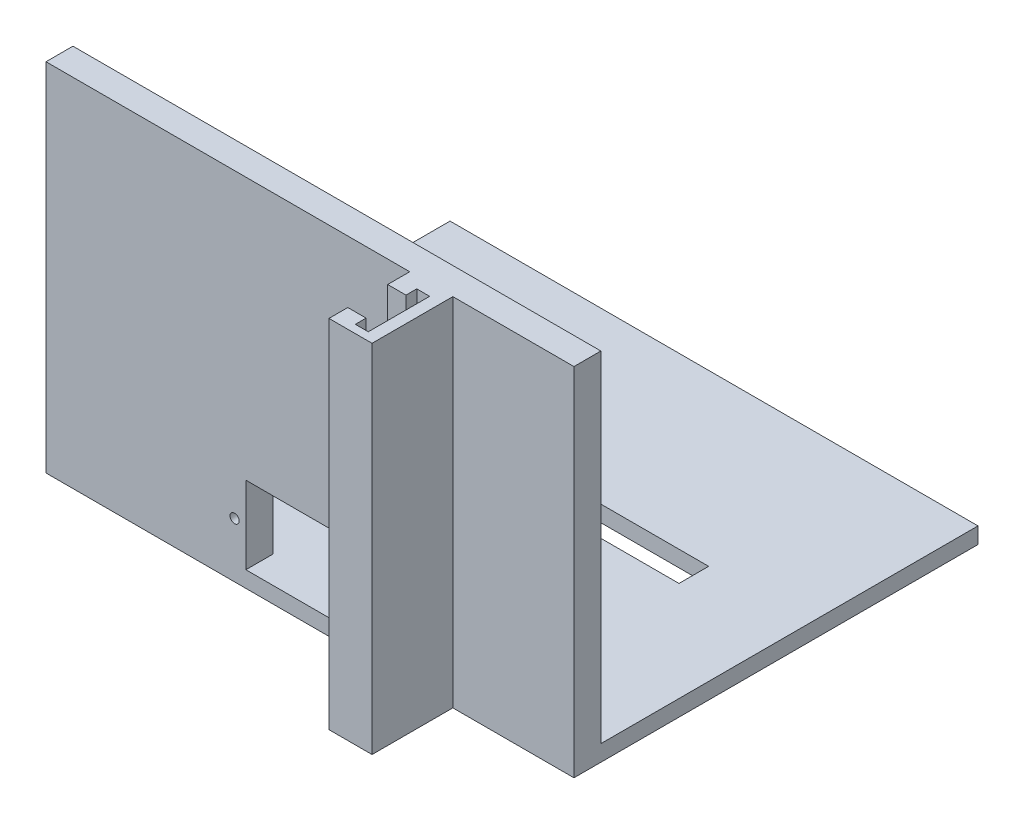
from build123d import *

# Parameters (mm, degrees)
SKETCH1_W               = 98
SKETCH1_H               = 111.829224908
SKETCH1_R               = 0.85
SKETCH1_W_2             = 23.8
SKETCH1_H_2             = 14.4
BOSS_EXTRUDE1_DEPTH     = 5
SKETCH3_W               = 98
SKETCH3_H               = 3
BOSS_EXTRUDE2_DEPTH     = 70
SKETCH4_W               = 61
SKETCH4_H               = 5.5
CUT_EXTRUDE1_DEPTH      = 50
CUT_EXTRUDE2_DEPTH      = 103.114856343
CUT_EXTRUDE2_DEPTH_BACK = 103.114856343
SKETCH5_W               = 98
SKETCH5_H               = 45.714612454
SKETCH6_W               = 8
SKETCH6_H               = 60
BOSS_EXTRUDE3_DEPTH     = 15
CUT_EXTRUDE3_DEPTH      = 109.037687776
BOSS_EXTRUDE4_DEPTH     = 6.114612454


with BuildPart() as part:
    # Sketch1 → Boss-Extrude1 (new body)
    with BuildSketch(Plane.XY):
        Rectangle(SKETCH1_W, SKETCH1_H)
        with Locations((14, 0)):
            Circle(SKETCH1_R, mode=Mode.SUBTRACT)
        with Locations((-14, 0)):
            Circle(SKETCH1_R, mode=Mode.SUBTRACT)
        Rectangle(SKETCH1_W_2, SKETCH1_H_2, mode=Mode.SUBTRACT)
    extrude(amount=BOSS_EXTRUDE1_DEPTH)

    # Sketch3 → Boss-Extrude2 (add)
    with BuildSketch(Plane(origin=(0, 0, 0), x_dir=(-1, 0, 0), z_dir=(0, 0, -1))):
        with Locations((0, -8.7)):
            Rectangle(SKETCH3_W, SKETCH3_H)
    extrude(amount=BOSS_EXTRUDE2_DEPTH)

    # Sketch4 → Cut-Extrude1 (cut)
    with BuildSketch(Plane(origin=(0, -7.2, 0), x_dir=(1, 0, 0), z_dir=(0, 1, 0))):
        with Locations((0, 35.75)):
            Rectangle(SKETCH4_W, SKETCH4_H)
    extrude(amount=-CUT_EXTRUDE1_DEPTH, mode=Mode.SUBTRACT)

    # Sketch5 → Cut-Extrude2 (cut, two sides: drawn at the far end of the back side and taken through both)
    with BuildSketch(Plane(origin=(0, 0, 0), x_dir=(-1, 0, 0), z_dir=(0, 0, -1)).offset(-CUT_EXTRUDE2_DEPTH_BACK)):
        with Locations((0, -33.057306227)):
            Rectangle(SKETCH5_W, SKETCH5_H)
    extrude(amount=CUT_EXTRUDE2_DEPTH + CUT_EXTRUDE2_DEPTH_BACK, mode=Mode.SUBTRACT)

    # Sketch6 → Boss-Extrude3 (add)
    with BuildSketch(Plane.XY.offset(5)):
        with Locations((22.52, 25.914612454)):
            Rectangle(SKETCH6_W, SKETCH6_H)
    extrude(amount=BOSS_EXTRUDE3_DEPTH)

    # Sketch7 → Cut-Extrude3 (cut, through all)
    with BuildSketch(Plane(origin=(0, 55.914612454, 0), x_dir=(1, 0, 0), z_dir=(0, 1, 0))):
        Polygon((18.52, -9.1), (21.92, -9.1), (21.92, -7.1), (24.32, -7.1), (24.32, -18.5), (21.92, -18.5), (21.92, -16.5), (18.52, -16.5), align=None)
    extrude(amount=-CUT_EXTRUDE3_DEPTH, mode=Mode.SUBTRACT)

    # Sketch8 → Boss-Extrude4 (add)
    with BuildSketch(Plane.XZ.offset(4.085387546)):
        Polygon((21.92, 7.1), (21.92, 9.1), (18.52, 9.1), (18.52, 5), (26.52, 5), (26.52, 20), (18.52, 20), (18.52, 16.5), (21.92, 16.5), (21.92, 18.5), (24.32, 18.5), (24.32, 7.1), align=None)
    extrude(amount=BOSS_EXTRUDE4_DEPTH)


solid = part.part
